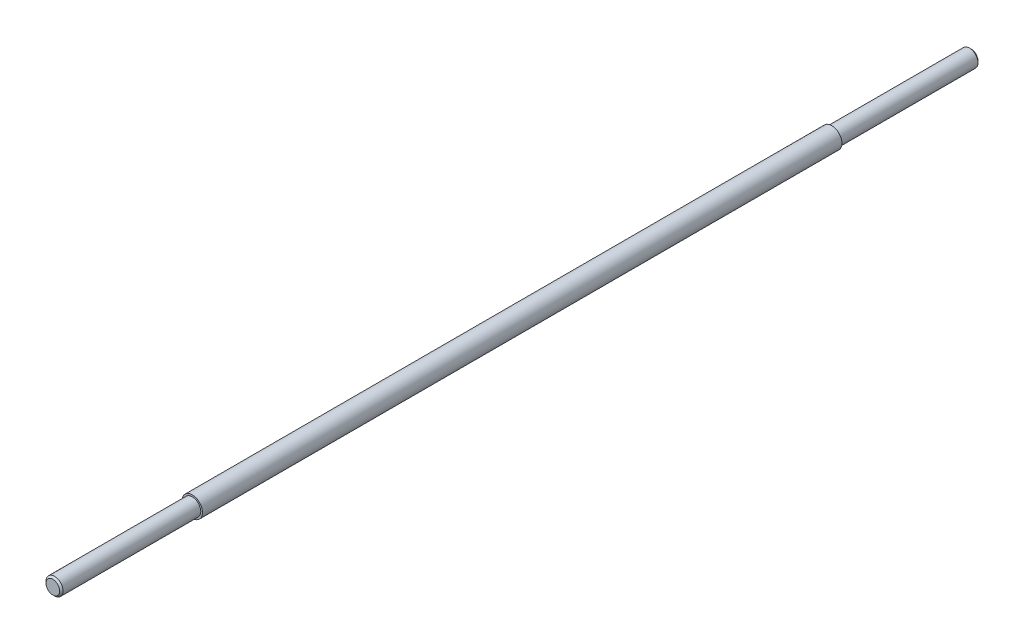
from build123d import *

# Parameters (mm, degrees)
SKETCH_1_R      = 3
EXTRUDE_1_DEPTH = 188
SKETCH_2_R      = 2.5
EXTRUDE_2_DEPTH = 41
EXTRUDE_START   = 41
SKETCH_3_R      = 2.5
EXTRUDE_3_DEPTH = 41
CHAMFER_1_SIZE  = 0.5


with BuildPart() as part:
    # 草图1 → 凸台-拉伸1 (new body)
    with BuildSketch(Plane.XY):
        with Locations((-7.816186841, 3.167153776)):
            Circle(SKETCH_1_R)
    extrude(amount=EXTRUDE_1_DEPTH)

    # 草图2 → 凸台-拉伸2 (add)
    with BuildSketch(Plane(origin=(0, 0, 0), x_dir=(-1, 0, 0), z_dir=(0, 0, -1))):
        with Locations(Location((7.816186841, 3.167153776, 0), (0, 0, 180))):
            Circle(SKETCH_2_R)
    extrude(amount=EXTRUDE_2_DEPTH)

    # 草图3 → 凸台-拉伸3 (add)
    with BuildSketch(Plane.XY.offset(188).offset(EXTRUDE_START)):
        with Locations((-7.816186841, 3.167153776)):
            Circle(SKETCH_3_R)
    extrude(amount=-EXTRUDE_3_DEPTH)

    # 倒角1
    chamfer_1_edges = [part.edges().sort_by_distance(p)[0] for p in [
        (-10.316186841, 3.167153776, 229),
        (-10.316186841, 3.167153776, -41),
    ]]
    chamfer(chamfer_1_edges, length=CHAMFER_1_SIZE)


solid = part.part
